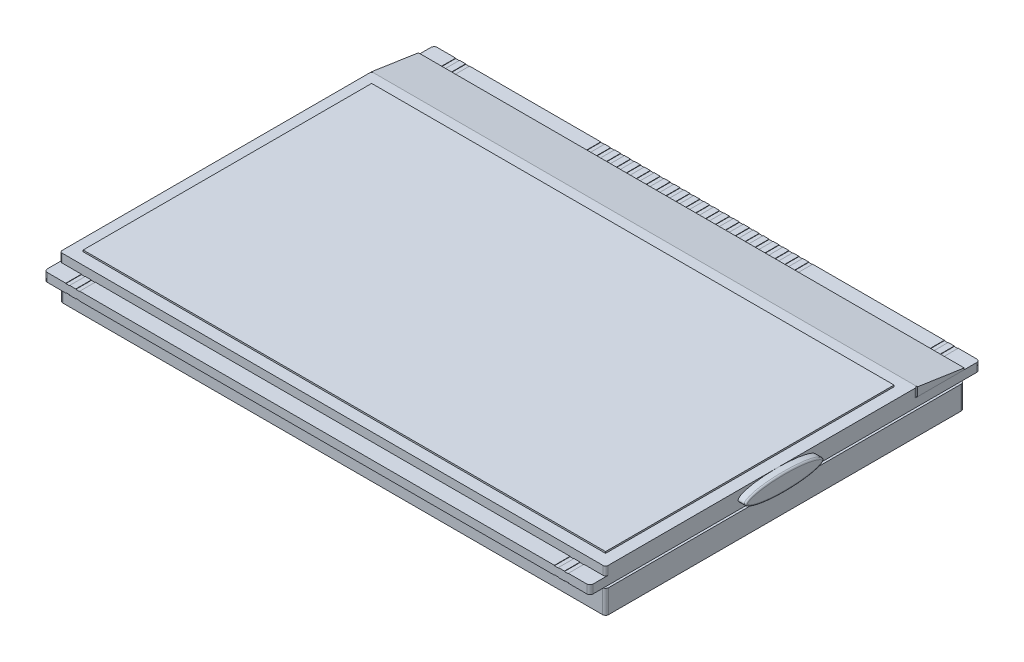
from build123d import *

# Parameters (mm, degrees)
BOSS_EXTRUDE1_DEPTH   = 1.1
SKETCH2_4_W           = 33.5
SKETCH2_4_H           = 37
BOSS_EXTRUDE2_DEPTH   = 1.3
SKETCH2_5_W           = 35
SKETCH2_5_H           = 8
SKETCH2_5_W_2         = 33.5
SKETCH2_5_H_2         = 37
SKETCH2_5_H_3         = 2
BOSS_EXTRUDE3_DEPTH   = 1.1
SKETCH4_W             = 67
SKETCH4_H             = 37
BOSS_EXTRUDE4_DEPTH   = 0.3
BOSS_EXTRUDE5_DEPTH   = 3
FILLET1_R             = 0.3
FILLET2_R             = 0.4
FILLET3_R             = 0.4
SKETCH9_W             = 1
SKETCH9_H             = 0.6
BOSS_EXTRUDE6_DEPTH   = 3
BOSS_EXTRUDE6_2_DEPTH = 3
SKETCH10_W            = 0.5
SKETCH10_H            = 2
SKETCH10_H_2          = 2.425715968
CUT_EXTRUDE2_DEPTH    = 0.05
SKETCH11_W            = 0.5
SKETCH11_H            = 2
CUT_EXTRUDE3_DEPTH    = 0.05
SKETCH12_W            = 0.5
SKETCH12_H            = 2
CUT_EXTRUDE4_DEPTH    = 0.05
SKETCH13_W            = 0.5
SKETCH13_H            = 2
CUT_EXTRUDE5_DEPTH    = 0.05
SKETCH15_RX           = 5
SKETCH15_RY           = 1.1
BOSS_EXTRUDE7_DEPTH   = 1
FILLET4_R             = 0.2
BOSS_EXTRUDE8_DEPTH   = 70


with BuildPart() as part:
    # Sketch2 → Boss-Extrude1 (new body)
    with BuildSketch(Plane(origin=(0, 0, 0), x_dir=(1, 0, 0), z_dir=(0, 1, 0))):
        Polygon((35, 19.025291829), (0, 19.025291829), (0, 17.525291829), (33.5, 17.525291829), (33.5, -19.474708171), (0, -19.474708171), (0, -20.974708171), (35, -20.974708171), align=None)
        Polygon((0, 17.525291829), (0, 19.025291829), (-35, 19.025291829), (-35, -20.974708171), (0, -20.974708171), (0, -19.474708171), (-33.5, -19.474708171), (-33.5, 17.525291829), align=None)
    extrude(amount=BOSS_EXTRUDE1_DEPTH)

    # Fillet1
    fillet1_edges = [part.edges().sort_by_distance(p)[0] for p in [
        (35, 0.55, -19.025291829),
        (35, 0.55, 20.974708171),
        (-35, 0.55, 20.974708171),
        (-35, 0.55, -19.025291829),
    ]]
    fillet(fillet1_edges, radius=FILLET1_R)



with BuildPart() as body_2:
    # Sketch2<4> → Boss-Extrude2 (new body)
    with BuildSketch(Plane(origin=(0, 0, 0), x_dir=(1, 0, 0), z_dir=(0, 1, 0))):
        with Locations((-16.75, -0.974708171)):
            Rectangle(SKETCH2_4_W, SKETCH2_4_H)
        with Locations((16.75, -0.974708171)):
            Rectangle(SKETCH2_4_W, SKETCH2_4_H)
    extrude(amount=BOSS_EXTRUDE2_DEPTH)


with BuildPart() as body_3:
    # Sketch2<5> → Boss-Extrude3 (new body)
    with BuildSketch(Plane(origin=(0, 0, 0), x_dir=(1, 0, 0), z_dir=(0, 1, 0))):
        with Locations((17.5, 23.025291829)):
            Rectangle(SKETCH2_5_W, SKETCH2_5_H)
        with Locations((-17.5, 23.025291829)):
            Rectangle(SKETCH2_5_W, SKETCH2_5_H)
        Polygon((35, 19.025291829), (0, 19.025291829), (0, 17.525291829), (33.5, 17.525291829), (33.5, -19.474708171), (0, -19.474708171), (0, -20.974708171), (35, -20.974708171), align=None)
        Polygon((0, 17.525291829), (0, 19.025291829), (-35, 19.025291829), (-35, -20.974708171), (0, -20.974708171), (0, -19.474708171), (-33.5, -19.474708171), (-33.5, 17.525291829), align=None)
        with Locations((16.75, -0.974708171)):
            Rectangle(SKETCH2_5_W_2, SKETCH2_5_H_2)
        with Locations((-16.75, -0.974708171)):
            Rectangle(SKETCH2_5_W_2, SKETCH2_5_H_2)
        with Locations((17.5, -21.974708171)):
            Rectangle(SKETCH2_5_W, SKETCH2_5_H_3)
        with Locations((-17.5, -21.974708171)):
            Rectangle(SKETCH2_5_W, SKETCH2_5_H_3)
    extrude(amount=-BOSS_EXTRUDE3_DEPTH)

    # Sketch4 → Boss-Extrude4 (add)
    with BuildSketch(Plane.XZ.offset(1.1)):
        with Locations((0, 0.974708171)):
            Rectangle(SKETCH4_W, SKETCH4_H)
    extrude(amount=BOSS_EXTRUDE4_DEPTH)

    # Fillet2
    fillet2_edges = [body_3.edges().sort_by_distance(p)[0] for p in [
        (35, -0.55, -27.025291829),
        (35, -0.55, 22.974708171),
        (-35, -0.55, 22.974708171),
        (-35, -0.55, -27.025291829),
    ]]
    fillet(fillet2_edges, radius=FILLET2_R)

    # Sketch10 → Cut-Extrude2 (cut)
    with BuildSketch(Plane(origin=(0, 0, 0), x_dir=(1, 0, 0), z_dir=(0, 1, 0))):
        with Locations((31.975, -21.974708171)):
            Rectangle(SKETCH10_W, SKETCH10_H)
        with Locations((30.695, -21.974708171)):
            Rectangle(SKETCH10_W, SKETCH10_H)
        with Locations((-30.695, 26.025291829)):
            Rectangle(SKETCH10_W, SKETCH10_H)
        with Locations((-31.975, 26.025291829)):
            Rectangle(SKETCH10_W, SKETCH10_H)
        with Locations((31.975, 26.025291829)):
            Rectangle(SKETCH10_W, SKETCH10_H)
        with Locations((30.695, 26.025291829)):
            Rectangle(SKETCH10_W, SKETCH10_H)
        with Locations((-30.695, -22.187566155)):
            Rectangle(SKETCH10_W, SKETCH10_H_2)
        with Locations((-31.975, -22.187566155)):
            Rectangle(SKETCH10_W, SKETCH10_H_2)
    extrude(amount=-CUT_EXTRUDE2_DEPTH, mode=Mode.SUBTRACT)

    # Sketch11 → Cut-Extrude3 (cut)
    with BuildSketch(Plane.XZ.offset(1.1)):
        with Locations((-31.975, 21.974708171)):
            Rectangle(SKETCH11_W, SKETCH11_H)
        with Locations((-30.695, 21.974708171)):
            Rectangle(SKETCH11_W, SKETCH11_H)
        with Locations((30.695, -26.025291829)):
            Rectangle(SKETCH11_W, SKETCH11_H)
        with Locations((31.975, -26.025291829)):
            Rectangle(SKETCH11_W, SKETCH11_H)
        with Locations((-30.695, -26.025291829)):
            Rectangle(SKETCH11_W, SKETCH11_H)
        with Locations((-31.975, -26.025291829)):
            Rectangle(SKETCH11_W, SKETCH11_H)
        with Locations((30.695, 21.974708171)):
            Rectangle(SKETCH11_W, SKETCH11_H)
        with Locations((31.975, 21.974708171)):
            Rectangle(SKETCH11_W, SKETCH11_H)
    extrude(amount=-CUT_EXTRUDE3_DEPTH, mode=Mode.SUBTRACT)

    # Sketch12 → Cut-Extrude4 (cut)
    with BuildSketch(Plane(origin=(0, 0, 0), x_dir=(1, 0, 0), z_dir=(0, 1, 0))):
        with Locations((13.305, 26.025291829)):
            Rectangle(SKETCH12_W, SKETCH12_H)
        with Locations((12.035, 26.025291829)):
            Rectangle(SKETCH12_W, SKETCH12_H)
        with Locations((10.765, 26.025291829)):
            Rectangle(SKETCH12_W, SKETCH12_H)
        with Locations((9.495, 26.025291829)):
            Rectangle(SKETCH12_W, SKETCH12_H)
        with Locations((8.225, 26.025291829)):
            Rectangle(SKETCH12_W, SKETCH12_H)
        with Locations((6.955, 26.025291829)):
            Rectangle(SKETCH12_W, SKETCH12_H)
        with Locations((5.685, 26.025291829)):
            Rectangle(SKETCH12_W, SKETCH12_H)
        with Locations((4.415, 26.025291829)):
            Rectangle(SKETCH12_W, SKETCH12_H)
        with Locations((3.145, 26.025291829)):
            Rectangle(SKETCH12_W, SKETCH12_H)
        with Locations((1.875, 26.025291829)):
            Rectangle(SKETCH12_W, SKETCH12_H)
        with Locations((0.605, 26.025291829)):
            Rectangle(SKETCH12_W, SKETCH12_H)
        with Locations((-0.665, 26.025291829)):
            Rectangle(SKETCH12_W, SKETCH12_H)
        with Locations((-1.935, 26.025291829)):
            Rectangle(SKETCH12_W, SKETCH12_H)
        with Locations((-3.205, 26.025291829)):
            Rectangle(SKETCH12_W, SKETCH12_H)
        with Locations((-4.475, 26.025291829)):
            Rectangle(SKETCH12_W, SKETCH12_H)
        with Locations((-5.745, 26.025291829)):
            Rectangle(SKETCH12_W, SKETCH12_H)
        with Locations((-7.015, 26.025291829)):
            Rectangle(SKETCH12_W, SKETCH12_H)
        with Locations((-8.285, 26.025291829)):
            Rectangle(SKETCH12_W, SKETCH12_H)
        with Locations((-9.555, 26.025291829)):
            Rectangle(SKETCH12_W, SKETCH12_H)
        with Locations((-10.825, 26.025291829)):
            Rectangle(SKETCH12_W, SKETCH12_H)
        with Locations((-12.095, 26.025291829)):
            Rectangle(SKETCH12_W, SKETCH12_H)
        with Locations((-13.365, 26.025291829)):
            Rectangle(SKETCH12_W, SKETCH12_H)
    extrude(amount=-CUT_EXTRUDE4_DEPTH, mode=Mode.SUBTRACT)

    # Sketch13 → Cut-Extrude5 (cut)
    with BuildSketch(Plane.XZ.offset(1.1)):
        with Locations((-10.825, -26.025291829)):
            Rectangle(SKETCH13_W, SKETCH13_H)
        with Locations((-9.555, -26.025291829)):
            Rectangle(SKETCH13_W, SKETCH13_H)
        with Locations((-8.285, -26.025291829)):
            Rectangle(SKETCH13_W, SKETCH13_H)
        with Locations((-7.015, -26.025291829)):
            Rectangle(SKETCH13_W, SKETCH13_H)
        with Locations((-5.745, -26.025291829)):
            Rectangle(SKETCH13_W, SKETCH13_H)
        with Locations((-4.475, -26.025291829)):
            Rectangle(SKETCH13_W, SKETCH13_H)
        with Locations((-12.095, -26.025291829)):
            Rectangle(SKETCH13_W, SKETCH13_H)
        with Locations((1.875, -26.025291829)):
            Rectangle(SKETCH13_W, SKETCH13_H)
        with Locations((3.145, -26.025291829)):
            Rectangle(SKETCH13_W, SKETCH13_H)
        with Locations((4.415, -26.025291829)):
            Rectangle(SKETCH13_W, SKETCH13_H)
        with Locations((5.685, -26.025291829)):
            Rectangle(SKETCH13_W, SKETCH13_H)
        with Locations((6.955, -26.025291829)):
            Rectangle(SKETCH13_W, SKETCH13_H)
        with Locations((0.605, -26.025291829)):
            Rectangle(SKETCH13_W, SKETCH13_H)
        with Locations((-0.665, -26.025291829)):
            Rectangle(SKETCH13_W, SKETCH13_H)
        with Locations((-1.935, -26.025291829)):
            Rectangle(SKETCH13_W, SKETCH13_H)
        with Locations((-3.205, -26.025291829)):
            Rectangle(SKETCH13_W, SKETCH13_H)
        with Locations((8.225, -26.025291829)):
            Rectangle(SKETCH13_W, SKETCH13_H)
        with Locations((9.495, -26.025291829)):
            Rectangle(SKETCH13_W, SKETCH13_H)
        with Locations((10.765, -26.025291829)):
            Rectangle(SKETCH13_W, SKETCH13_H)
        with Locations((12.035, -26.025291829)):
            Rectangle(SKETCH13_W, SKETCH13_H)
        with Locations((13.305, -26.025291829)):
            Rectangle(SKETCH13_W, SKETCH13_H)
        with Locations((-13.365, -26.025291829)):
            Rectangle(SKETCH13_W, SKETCH13_H)
    extrude(amount=-CUT_EXTRUDE5_DEPTH, mode=Mode.SUBTRACT)


with BuildPart() as body_4:
    # Sketch5 → Boss-Extrude5 (new body)
    with BuildSketch(Plane.XZ.offset(1.4)):
        Polygon((35, -19.025291829), (35, -25.025291829), (-35, -25.025291829), (-35, -19.025291829), (-35, 20.974708171), (35, 20.974708171), align=None)
    extrude(amount=BOSS_EXTRUDE5_DEPTH)

    # Fillet3
    fillet3_edges = [body_4.edges().sort_by_distance(p)[0] for p in [
        (35, -2.9, -25.025291829),
        (-35, -2.9, -25.025291829),
        (-35, -2.9, 20.974708171),
        (35, -2.9, 20.974708171),
    ]]
    fillet(fillet3_edges, radius=FILLET3_R)


with BuildPart() as body_5:
    # Sketch9 → Boss-Extrude6 (new body)
    with BuildSketch(Plane.XZ.offset(4.4)):
        with Locations((24.5, -23.725291829)):
            Rectangle(SKETCH9_W, SKETCH9_H)
    extrude(amount=BOSS_EXTRUDE6_DEPTH)


with BuildPart() as body_6:
    # Sketch9 → Boss-Extrude6 2 (new body)
    with BuildSketch(Plane.XZ.offset(4.4)):
        with Locations((-24.5, -23.725291829)):
            Rectangle(SKETCH9_W, SKETCH9_H)
    extrude(amount=BOSS_EXTRUDE6_2_DEPTH)


with BuildPart() as part_1:
    add(part.part)

    add(body_3.part)  # Boss-Extrude7 merges body 3
    # Sketch15 → Boss-Extrude7 (add)
    with BuildSketch(Plane(origin=(35, 0, 0), x_dir=(0, 0, -1), z_dir=(1, 0, 0))):
        with Locations(Location((1.025291829, 0), (0, 0, 0))):
            Ellipse(SKETCH15_RX, SKETCH15_RY)
    extrude(amount=BOSS_EXTRUDE7_DEPTH)

    # Fillet4
    fillet4_edges = [part_1.edges().sort_by_distance(p)[0] for p in [
        (36, -0.09001858, 3.957937598),
    ]]
    fillet(fillet4_edges, radius=FILLET4_R)


with BuildPart() as body_6_2:
    # Sketch16 → Boss-Extrude8 (new body)
    with BuildSketch(Plane(origin=(35, 0, 0), x_dir=(0, 0, -1), z_dir=(1, 0, 0))):
        Polygon((25.025291829, 0), (25.025291829, 0.2), (19.025291829, 1.1), (19.025291829, 0), align=None)
    extrude(amount=-BOSS_EXTRUDE8_DEPTH)


solid = Compound([body_2.part, body_4.part, body_5.part, body_6.part, part_1.part, body_6_2.part])
